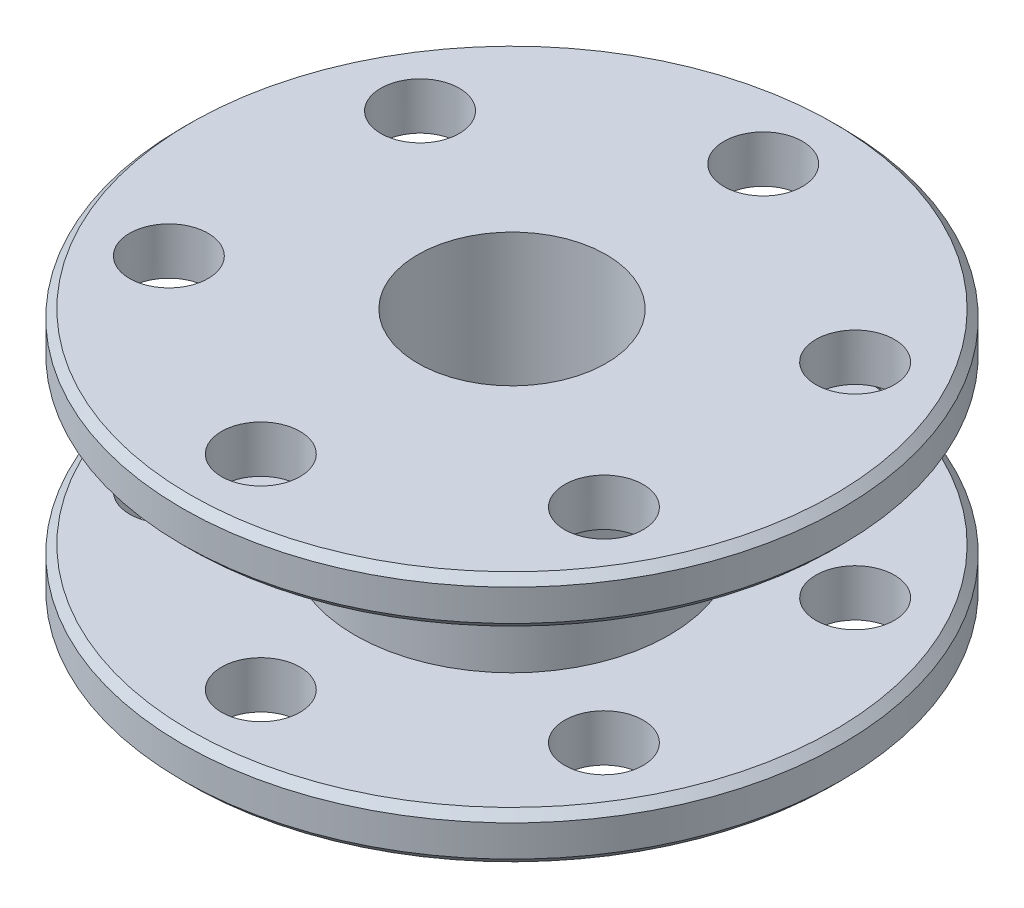
from build123d import *

# Parameters (mm, degrees)
CHAMFER1_SIZE      = 0.5
SKETCH2_R          = 2.5
CUT_EXTRUDE1_DEPTH = 34.734255587


with BuildPart() as part:
    # Sketch1 → Revolve1 (revolve)
    with BuildSketch(Plane.XY, mode=Mode.PRIVATE) as revolve1_sk:
        Polygon((6, 0), (6, 16), (21, 16), (21, 13), (10, 13), (10, 3), (21, 3), (21, 0), align=None)
    revolve(revolve1_sk.sketch.rotate(Axis((0, 0, 0), (0, 1, 0)), 90), axis=Axis((0, 0, 0), (0, 1, 0)))

    # Chamfer1
    chamfer1_edges = [part.edges().sort_by_distance(p)[0] for p in [
        (0, 0, 21),
        (0, 3, 21),
        (0, 13, 21),
        (0, 16, 21),
    ]]
    chamfer(chamfer1_edges, length=CHAMFER1_SIZE)

    # Sketch2 → Cut-Extrude1 (cut, through all)
    with BuildSketch(Plane(origin=(0, 16, 0), x_dir=(1, 0, 0), z_dir=(0, 1, 0))):
        with Locations(Location((0, 16, 0), (0, 0, 270))):
            Circle(SKETCH2_R)
        with Locations(Location((13.856406461, 8, 0), (0, 0, 270))):
            Circle(SKETCH2_R)
        with Locations(Location((13.856406461, -8, 0), (0, 0, 270))):
            Circle(SKETCH2_R)
        with Locations(Location((0, -16, 0), (0, 0, 270))):
            Circle(SKETCH2_R)
        with Locations(Location((-13.856406461, -8, 0), (0, 0, 270))):
            Circle(SKETCH2_R)
        with Locations(Location((-13.856406461, 8, 0), (0, 0, 270))):
            Circle(SKETCH2_R)
    extrude(amount=-CUT_EXTRUDE1_DEPTH, mode=Mode.SUBTRACT)


solid = part.part
